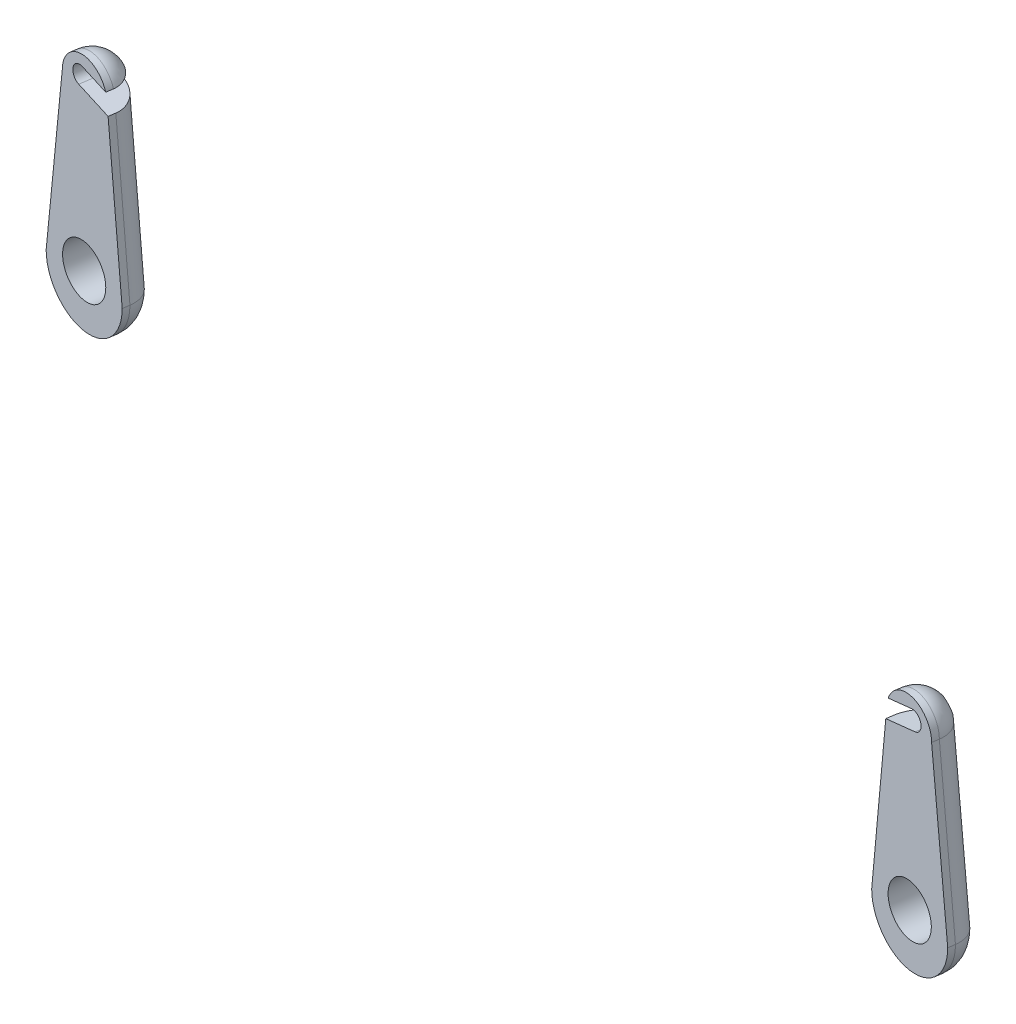
from build123d import *

# Parameters (mm, degrees)
BASE_EXTRUDE_DEPTH = 6.35
FILLET1_R          = 5
CUT_EXTRUDE1_REACH = 245.045
SKETCH4_R          = 5.05
CUT_EXTRUDE2_DEPTH = 6.35


with BuildPart() as part:
    # Sketch1 → Base Extrude (new body)
    with BuildSketch(Plane(origin=(8.114628625, -3.283425705, -55.67660861), x_dir=(-0.98954535441322, 0, -0.14422202175539944), z_dir=(0.14422202175539944, 0, -0.98954535441322))):
        with BuildLine():
            Line((-1.106091457, 204.084448373), (2.665349365, 237.084448373))
            ThreePointArc((2.665349365, 237.084448373), (7.915349365, 242.334448373), (13.165349365, 237.084448373))
            Line((13.165349365, 237.084448373), (16.673908543, 204.084448373))
            ThreePointArc((16.673908543, 204.084448373), (7.783908543, 195.194448373), (-1.106091457, 204.084448373))
        make_face()
    extrude(amount=BASE_EXTRUDE_DEPTH)

    # Fillet1
    fillet1_edges = [part.edges().sort_by_distance(p)[0] for p in [
        (1.19784127, 239.051022668, -63.101789298),
        (8.258960253, 217.301022668, -62.072661274),
        (1.327907925, 191.911022668, -63.082832637),
        (-5.733211058, 217.301022668, -64.111960662),
    ]]
    fillet(fillet1_edges, radius=FILLET1_R)

    # Cut-Extrude1: up to this face of the body (flat: up to its plane)
    cut_extrude1_end = Plane(part.part.faces().sort_by_distance((0.359463879, 213.5685835, -56.806890849))[0])
    # Sketch3 → Cut-Extrude1 (cut, up to the picked face)
    with BuildSketch(Plane(origin=(9.030438463, -3.283425705, -61.96022161), x_dir=(-0.98954535441322, 0, -0.14422202175539942), z_dir=(0.14422202175539942, 0, -0.98954535441322)), mode=Mode.PRIVATE) as cut_extrude1_sk1:
        with BuildLine():
            Line((14.3026167, 234.886394841), (6.516843813, 236.725345777))
            ThreePointArc((6.516843813, 236.725345777), (5.178808874, 238.890908637), (7.344371734, 240.228943576))
            Line((7.344371734, 240.228943576), (15.130144622, 238.38999264))
            ThreePointArc((15.130144622, 238.38999264), (16.468179561, 236.22442978), (14.3026167, 234.886394841))
        make_face()
    cut_extrude1_tool1 = split(extrude(cut_extrude1_sk1.sketch, amount=-CUT_EXTRUDE1_REACH, mode=Mode.PRIVATE), bisect_by=cut_extrude1_end, keep=Keep.BOTH, mode=Mode.PRIVATE)
    add(cut_extrude1_tool1.solids().sort_by(Axis((-1.6799, 234.274244, -63.521208), (-0.14422202175539942, 0, 0.98954535441322)))[0], mode=Mode.SUBTRACT)


with BuildPart() as body_2:
    # Mirror2: mirrored copy
    add(part.part.mirror(Plane(origin=(-103.213448145, 0, -15.042920567), x_dir=(-0.14422202175539944, 0, 0.98954535441322), z_dir=(0.98954535441322, 0, 0.14422202175539944))))


with BuildPart() as part_1:
    add(part.part)

    # Sketch4 → Cut-Extrude2 (cut)
    with BuildSketch(Plane(origin=(9.030438463, 0, -61.96022161), x_dir=(-0.98954535441322, 0, -0.14422202175539944), z_dir=(0.14422202175539944, 0, -0.98954535441322))):
        with Locations((7.783908543, 202.201022668)):
            Circle(SKETCH4_R)
    cut_extrude2 = extrude(amount=-CUT_EXTRUDE2_DEPTH, mode=Mode.SUBTRACT)


with BuildPart() as body_2_1:
    add(body_2.part)

    # Mirror3: Cut-Extrude2 across plane
    add(cut_extrude2.mirror(Plane(origin=(-103.213448145, 0, -15.042920567), x_dir=(-0.14422202175539944, 0, 0.98954535441322), z_dir=(0.98954535441322, 0, 0.14422202175539944))), mode=Mode.SUBTRACT)


solid = Compound([part_1.part, body_2_1.part])
